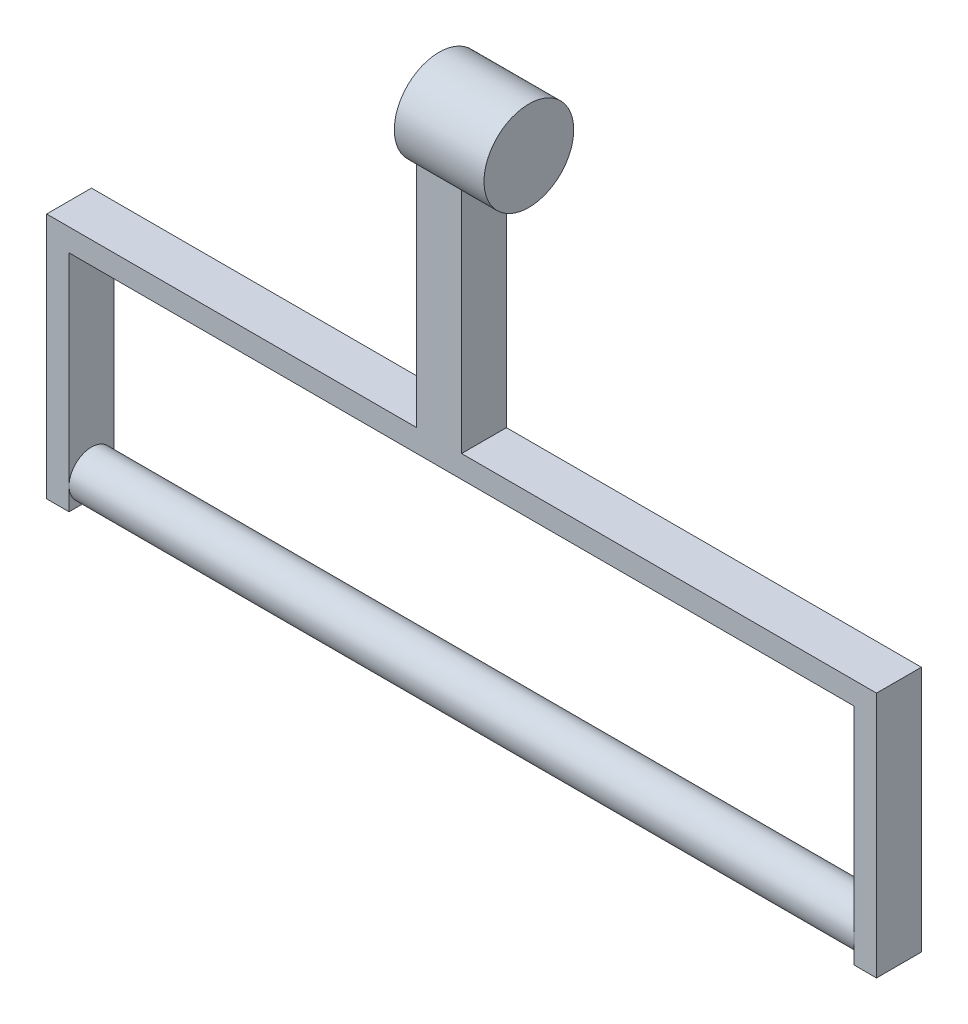
from build123d import *
from build123d.topology import SkipClean

# Parameters (mm, degrees)
EXTRUDE_1_DEPTH     = 10
EXTRUDE_START       = -10
EXTRUDE_2_DEPTH     = 10
SKETCH_2_W          = 5
SKETCH_2_H          = 10
EXTRUDE_6_DEPTH     = 55
EXTRUDE_6_2_DEPTH   = 55
SKETCH_2_5_W        = 180
SKETCH_2_5_H        = 10
EXTRUDE_7_DEPTH     = 5
SKETCH_5_R          = 5
EXTRUDE_8_DEPTH     = 175
CUT_EXTRUDE_1_DEPTH = 175
SKETCH_7_W          = 10
SKETCH_7_H          = 10
CUT_EXTRUDE_2_DEPTH = 50
EXTRUDE_9_DEPTH     = 10
SKETCH_8_3_R        = 10
EXTRUDE_10_DEPTH    = 10


with BuildPart() as part:
    # 草图1 → 凸台-拉伸1 (new body)
    with BuildSketch(Plane.XY):
        with BuildLine():
            Line((10, -60), (10, 0))
            ThreePointArc((10, 0), (0, 10), (-10, 0))
            Line((-10, 0), (-10, -60))
            Line((-10, -60), (10, -60))
        make_face()
    extrude(amount=EXTRUDE_1_DEPTH)

    # 草图1<4> → 凸台-拉伸2 (add)
    with BuildSketch(Plane.XY.offset(EXTRUDE_START)):
        with BuildLine():
            ThreePointArc((10, 0), (0, 10), (-10, 0))
            ThreePointArc((-10, 0), (0, -10), (10, 0))
        make_face()
    extrude(amount=EXTRUDE_2_DEPTH)



with BuildPart() as body_2:
    # 草图2 → 凸台-拉伸6 (new body)
    with BuildSketch(Plane.XZ.offset(60)):
        with Locations((-90, 5)):
            Rectangle(SKETCH_2_W, SKETCH_2_H)
    extrude(amount=EXTRUDE_6_DEPTH)


with BuildPart() as body_3:
    # 草图2 → Extrude 6 2 (new body)
    with BuildSketch(Plane.XZ.offset(60)):
        with Locations((90, 5)):
            Rectangle(SKETCH_2_W, SKETCH_2_H)
    extrude(amount=EXTRUDE_6_2_DEPTH)


with BuildPart() as part_1:
    add(part.part)

    add(body_2.part)  # 凸台-拉伸7 merges body 2

    add(body_3.part)  # 凸台-拉伸7 merges body 3
    # 草图2<5> → 凸台-拉伸7 (add)
    with BuildSketch(Plane.XZ.offset(60)):
        with Locations((-2.5, 5)):
            Rectangle(SKETCH_2_5_W, SKETCH_2_5_H)
    extrude(amount=EXTRUDE_7_DEPTH)

    # 草图5 → 凸台-拉伸8 (add)
    with BuildSketch(Plane(origin=(-87.5, 0, 0), x_dir=(0, 0, -1), z_dir=(1, 0, 0))):
        with Locations((-5, -110)):
            Circle(SKETCH_5_R)
    extrude(amount=EXTRUDE_8_DEPTH)

    # 草图6 → 切除-拉伸1 (cut)
    with BuildSketch(Plane(origin=(0, 0, -10), x_dir=(-1, 0, 0), z_dir=(0, 0, -1))):
        with BuildLine():
            ThreePointArc((10, 0), (7.071067812, -7.071067812), (0, -10))
            Line((0, -10), (10, -10))
            Line((10, -10), (10, 0))
        make_face()
        with BuildLine():
            Line((-10, -10), (0, -10))
            ThreePointArc((0, -10), (-7.071067812, -7.071067812), (-10, 0))
            Line((-10, 0), (-10, -10))
        make_face()
        with BuildLine():
            ThreePointArc((-2.7e-08, 10), (7.071067802, 7.071067821), (10, 0))
            Line((10, 0), (10, 10))
            Line((10, 10), (-2.7e-08, 10))
        make_face()
        with BuildLine():
            Line((-10, 10), (-10, 0))
            ThreePointArc((-10, 0), (-7.071067821, 7.071067802), (-2.7e-08, 10))
            Line((-2.7e-08, 10), (-10, 10))
        make_face()
    extrude(amount=-CUT_EXTRUDE_1_DEPTH, mode=Mode.SUBTRACT)


with BuildPart() as cut_extrude_1_kept_piece:
    # of the separate pieces the step leaves, the one the design keeps (cut_extrude_1_pieces_kept)
    add(part_1.part.solids().sort_by_distance((-87.5, -65, 0))[0])

    # 草图7 → 切除-拉伸2 (cut)
    with BuildSketch(Plane(origin=(0, -10, 0), x_dir=(1, 0, 0), z_dir=(0, 1, 0))):
        with Locations((5, -5)):
            Rectangle(SKETCH_7_W, SKETCH_7_H)
    extrude(amount=-CUT_EXTRUDE_2_DEPTH, mode=Mode.SUBTRACT)

    # 草图8 → 凸台-拉伸9 (add)
    with BuildSketch(Plane(origin=(0, 0, 0), x_dir=(0, 0, -1), z_dir=(1, 0, 0))):
        with BuildLine():
            Line((-10, -8.660254038), (-10, -10))
            Line((-10, -10), (0, -10))
            Line((0, -10), (0, -8.660254038))
            ThreePointArc((0, -8.660254038), (-5, 10), (-10, -8.660254038))
        make_face()
    extrude(amount=-EXTRUDE_9_DEPTH)

    # 草图8<3> → 凸台-拉伸10 (add)
    with SkipClean():  # the faces are left unmerged after this step: merging them gives an invalid solid
        with BuildSketch(Plane(origin=(0, 0, 0), x_dir=(0, 0, -1), z_dir=(1, 0, 0))):
            with Locations((-5, 0)):
                Circle(SKETCH_8_3_R)
        extrude(amount=EXTRUDE_10_DEPTH)


solid = cut_extrude_1_kept_piece.part
